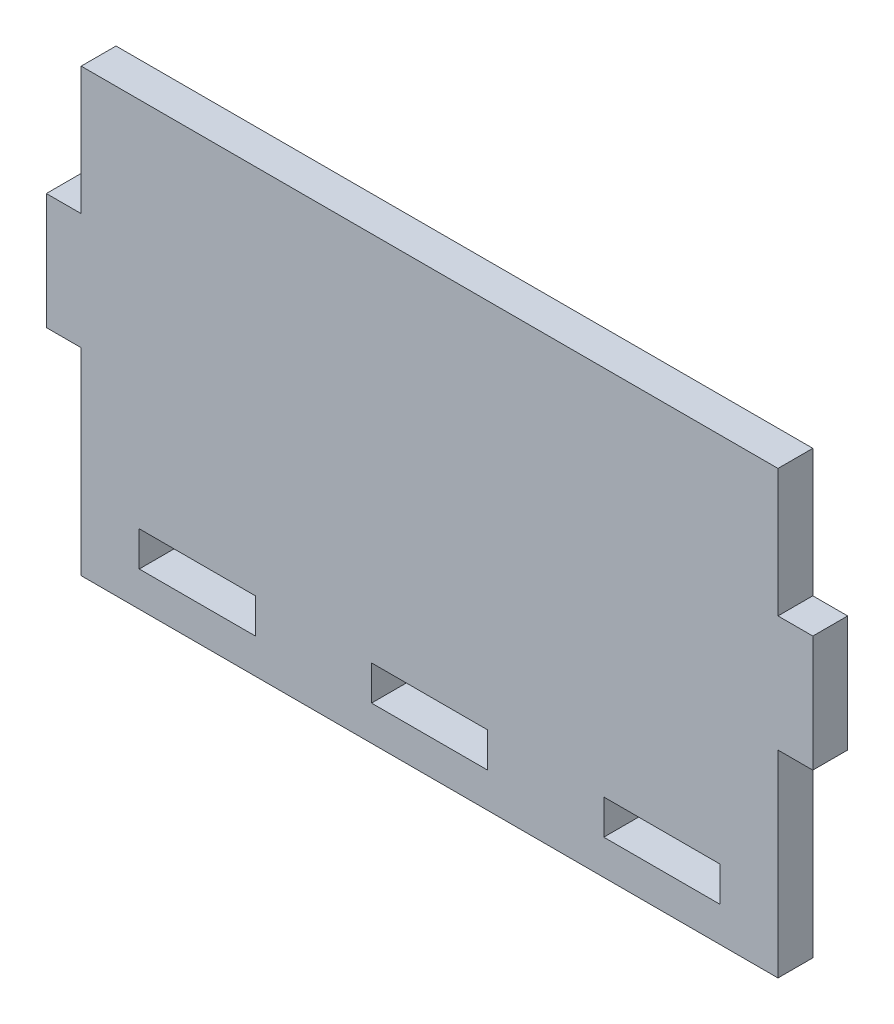
from build123d import *

# Parameters (mm, degrees)
SKETCH1_W           = 10
SKETCH1_H           = 3
SKETCH1_W_2         = 3
SKETCH1_H_2         = 10
BOSS_EXTRUDE1_DEPTH = 3


with BuildPart() as part:
    # Sketch1 → Boss-Extrude1 (new body)
    # profile 1 of 4: a face of its own
    with BuildSketch(Plane.XY):
        Polygon((-2.850678733, -16.932126697), (-2.850678733, 15.067873303), (-32.850678733, 15.067873303), (-32.850678733, 4.067873303), (-32.850678733, -5.932126697), (-32.850678733, -22.932126697), (-2.850678733, -22.932126697), (-2.850678733, -19.932126697), (-7.850678733, -19.932126697), (-7.850678733, -16.932126697), align=None)
        with Locations((-22.850678733, -18.432126697)):
            Rectangle(SKETCH1_W, SKETCH1_H, mode=Mode.SUBTRACT)
    # profile 2 of 4: a face of its own
    with BuildSketch(Plane.XY):
        Polygon((27.149321267, 15.067873303), (-2.850678733, 15.067873303), (-2.850678733, -16.932126697), (2.149321267, -16.932126697), (2.149321267, -19.932126697), (-2.850678733, -19.932126697), (-2.850678733, -22.932126697), (27.149321267, -22.932126697), (27.149321267, -5.932126697), (27.149321267, 4.067873303), align=None)
        with Locations((17.149321267, -18.432126697)):
            Rectangle(SKETCH1_W, SKETCH1_H, mode=Mode.SUBTRACT)
    # profile 3 of 4: a face of its own
    with BuildSketch(Plane.XY):
        with Locations((-34.350678733, -0.932126697)):
            Rectangle(SKETCH1_W_2, SKETCH1_H_2)
    # profile 4 of 4: a face of its own
    with BuildSketch(Plane.XY):
        with Locations((28.649321267, -0.932126697)):
            Rectangle(SKETCH1_W_2, SKETCH1_H_2)
    extrude(amount=BOSS_EXTRUDE1_DEPTH)


solid = part.part
